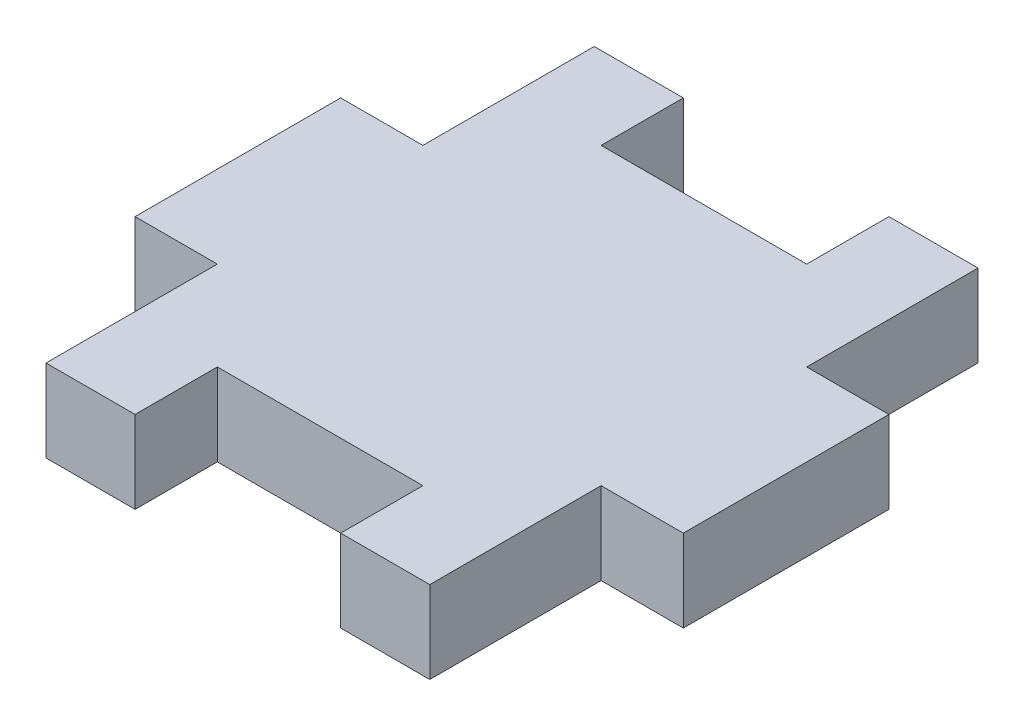
from build123d import *

# Parameters (mm, degrees)
SALIENTE_EXTRUIR1_DEPTH = 6


with BuildPart() as part:
    # Croquis1 → Saliente-Extruir1 (new body)
    with BuildSketch(Plane(origin=(0, 0, 0), x_dir=(1, 0, 0), z_dir=(0, 1, 0))):
        Polygon((40, 12.5), (40, 27.5), (34, 27.5), (34, 40), (27.5, 40), (27.5, 34), (12.5, 34), (12.5, 40), (6, 40), (6, 27.5), (0, 27.5), (0, 12.5), (6, 12.5), (6, 0), (12.5, 0), (12.5, 6), (27.5, 6), (27.5, 0), (34, 0), (34, 12.5), align=None)
    extrude(amount=SALIENTE_EXTRUIR1_DEPTH)


solid = part.part
